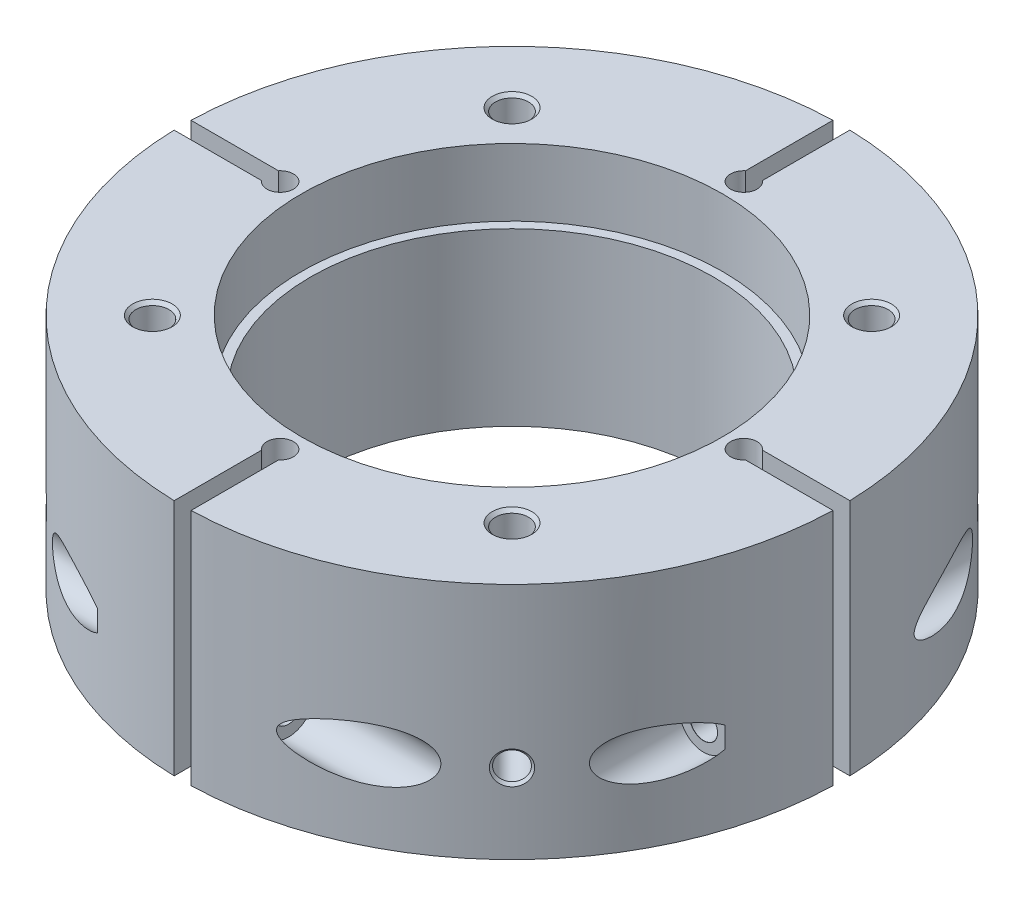
from build123d import *

# Parameters (mm, degrees)
IZIM1_R                     = 38
Y_KSEKLIK_EKSTR_ZYON1_DEPTH = 45
KES_EKSTR_ZYON4_START       = -57
IZIM31_R                    = 4.5
KES_EKSTR_ZYON4_DEPTH       = 40
DAIRESEL_KAPLAMA1_COUNT     = 4
DAIRESEL_KAPLAMA2_COUNT     = 4
CIRPATTERN1_COUNT           = 4
SKETCH3_R                   = 39.75
CUT_EXTRUDE1_DEPTH          = 12.7


with BuildPart() as part:
    # Çizim1 → Yükseklik-Ekstrüzyon1 (new body)
    with BuildSketch(Plane(origin=(0, 0, 0), x_dir=(1, 0, 0), z_dir=(0, 1, 0))):
        with BuildLine():
            Line((-1.600210522, 45.679283086), (-1.60525725, 62.179282315))
            ThreePointArc((-1.60525725, 62.179282315), (-43.985760277, 43.978322988), (-62.179552872, 1.594742816))
            Line((-62.179552872, 1.594742816), (-45.679553644, 1.599789545))
            ThreePointArc((-45.679553644, 1.599789545), (-41.258481142, 0.000163298), (-45.679283086, -1.600210522))
            Line((-45.679283086, -1.600210522), (-62.179282315, -1.60525725))
            ThreePointArc((-62.179282315, -1.60525725), (-43.978322988, -43.985760277), (-1.594742816, -62.179552872))
            Line((-1.594742816, -62.179552872), (-1.599789545, -45.679553644))
            ThreePointArc((-1.599789545, -45.679553644), (-0.000163298, -41.258481142), (1.600210522, -45.679283086))
            Line((1.600210522, -45.679283086), (1.60525725, -62.179282315))
            ThreePointArc((1.60525725, -62.179282315), (43.985760277, -43.978322988), (62.179552872, -1.594742816))
            Line((62.179552872, -1.594742816), (45.679553644, -1.599789545))
            ThreePointArc((45.679553644, -1.599789545), (41.258481142, -0.000163298), (45.679283086, 1.600210522))
            Line((45.679283086, 1.600210522), (62.179282315, 1.60525725))
            ThreePointArc((62.179282315, 1.60525725), (43.978322988, 43.985760277), (1.594742816, 62.179552872))
            Line((1.594742816, 62.179552872), (1.599789545, 45.679553644))
            ThreePointArc((1.599789545, 45.679553644), (0.000163298, 41.258481142), (-1.600210522, 45.679283086))
        make_face()
        Circle(IZIM1_R, mode=Mode.SUBTRACT)
    extrude(amount=Y_KSEKLIK_EKSTR_ZYON1_DEPTH)

    # Çizim3 → M5 Altıgen Alyan Başlı Kör Vida İçin Havşa1 (revolve, cut)
    with BuildSketch(Plane(origin=(-55.179282315, 15.156467904, 38), x_dir=(0, -1, 0), z_dir=(1, 0, 0))):
        Polygon((0, 0), (0, 39.742495795), (2.9, 38), (2.9, 25), (5, 25), (5, 0.025), (5.025, 0), align=None)
    m5_alt_gen_alyan_ba_l_k_r_vida_in_hav = revolve(axis=Axis((-55.179282315, 15.156467904, 44.35), (0, 0, -1)), mode=Mode.SUBTRACT)

    # Çizim31 → Kes-Ekstrüzyon4 (cut)
    with BuildSketch(Plane.XY.offset(38).offset(KES_EKSTR_ZYON4_START)):
        with Locations((-55.179282315, 15.156467904)):
            Circle(IZIM31_R)
    kes_ekstr_zyon4 = extrude(amount=-KES_EKSTR_ZYON4_DEPTH, mode=Mode.SUBTRACT)

    # Çizim6 → M5 Helisarmal için Zıvana matkabı3 (revolve, cut)
    with BuildSketch(Plane(origin=(-55.179282315, 15.156467904, -19), x_dir=(0, 1, 0), z_dir=(1, 0, 0))):
        Polygon((0, 0), (0, 19.562237609), (2.6, 18), (2.6, 0.025), (2.625, 0), align=None)
    m5_helisarmal_i_in_z_vana_matkab_3 = revolve(axis=Axis((-55.179282315, 15.156467904, -25.35), (0, 0, 1)), mode=Mode.SUBTRACT)

    # Çizim8 → M5x0.8 Helisarmal İçin Dişli Delik1 (revolve, cut)
    with BuildSketch(Plane(origin=(-43.98204179, 15, 43.98204179), x_dir=(0.7071067811865492, 0, 0.7071067811865459), z_dir=(0, 1, 0))):
        Polygon((0, 0), (0, 12), (2.6, 11.053677391), (2.6, 0.4975), (3.0975, 0), align=None)
    m5x0_8_helisarmal_in_di_li_delik1 = revolve(axis=Axis((-48.47216985, 15, 48.47216985), (0.7071067811865458, 0, -0.7071067811865492)), mode=Mode.SUBTRACT)

    # Dairesel Kaplama1: M5 Altıgen Alyan Başlı Kör Vida İçin Havşa1, Kes-Ekstrüzyon4, M5 Helisarmal için Zıvana matkabı3 ×4 about axis
    dairesel_kaplama1_axis = Axis((0, 45, 0), (0, -1, 0))
    add([m5_alt_gen_alyan_ba_l_k_r_vida_in_hav.rotate(dairesel_kaplama1_axis, i * 360 / DAIRESEL_KAPLAMA1_COUNT) for i in range(1, DAIRESEL_KAPLAMA1_COUNT)], mode=Mode.SUBTRACT)
    add([kes_ekstr_zyon4.rotate(dairesel_kaplama1_axis, i * 360 / DAIRESEL_KAPLAMA1_COUNT) for i in range(1, DAIRESEL_KAPLAMA1_COUNT)], mode=Mode.SUBTRACT)
    add([m5_helisarmal_i_in_z_vana_matkab_3.rotate(dairesel_kaplama1_axis, i * 360 / DAIRESEL_KAPLAMA1_COUNT) for i in range(1, DAIRESEL_KAPLAMA1_COUNT)], mode=Mode.SUBTRACT)

    # Dairesel Kaplama2: M5x0.8 Helisarmal İçin Dişli Delik1 ×4 about axis
    dairesel_kaplama2_axis = Axis((0, 45, 0), (0, -1, 0))
    for i in range(1, DAIRESEL_KAPLAMA2_COUNT):
        add(m5x0_8_helisarmal_in_di_li_delik1.rotate(dairesel_kaplama2_axis, i * 360 / DAIRESEL_KAPLAMA2_COUNT), mode=Mode.SUBTRACT)

    # Sketch2 → Tapped Hole for M6x1.0 Helicoil2 (revolve, cut)
    with BuildSketch(Plane(origin=(-33.941125497, 45, -33.941125497), x_dir=(0, 0, 1), z_dir=(1, 0, 0))):
        Polygon((0, 0), (0, 15), (3.125, 13.862593018), (3.125, 0.611), (3.736, 0), align=None)
    tapped_hole_for_m6x1_0_helicoil2 = revolve(axis=Axis((-33.941125497, 51.35, -33.941125497), (0, -1, 0)), mode=Mode.SUBTRACT)

    # CirPattern1: Tapped Hole for M6x1.0 Helicoil2 ×4 about axis
    cirpattern1_axis = Axis((0, 45, 0), (0, 1, 0))
    for i in range(1, CIRPATTERN1_COUNT):
        add(tapped_hole_for_m6x1_0_helicoil2.rotate(cirpattern1_axis, i * 360 / CIRPATTERN1_COUNT), mode=Mode.SUBTRACT)

    # Sketch3 → Cut-Extrude1 (cut)
    with BuildSketch(Plane(origin=(0, 45, 0), x_dir=(1, 0, 0), z_dir=(0, 1, 0))):
        Circle(SKETCH3_R)
    extrude(amount=-CUT_EXTRUDE1_DEPTH, mode=Mode.SUBTRACT)


solid = part.part
